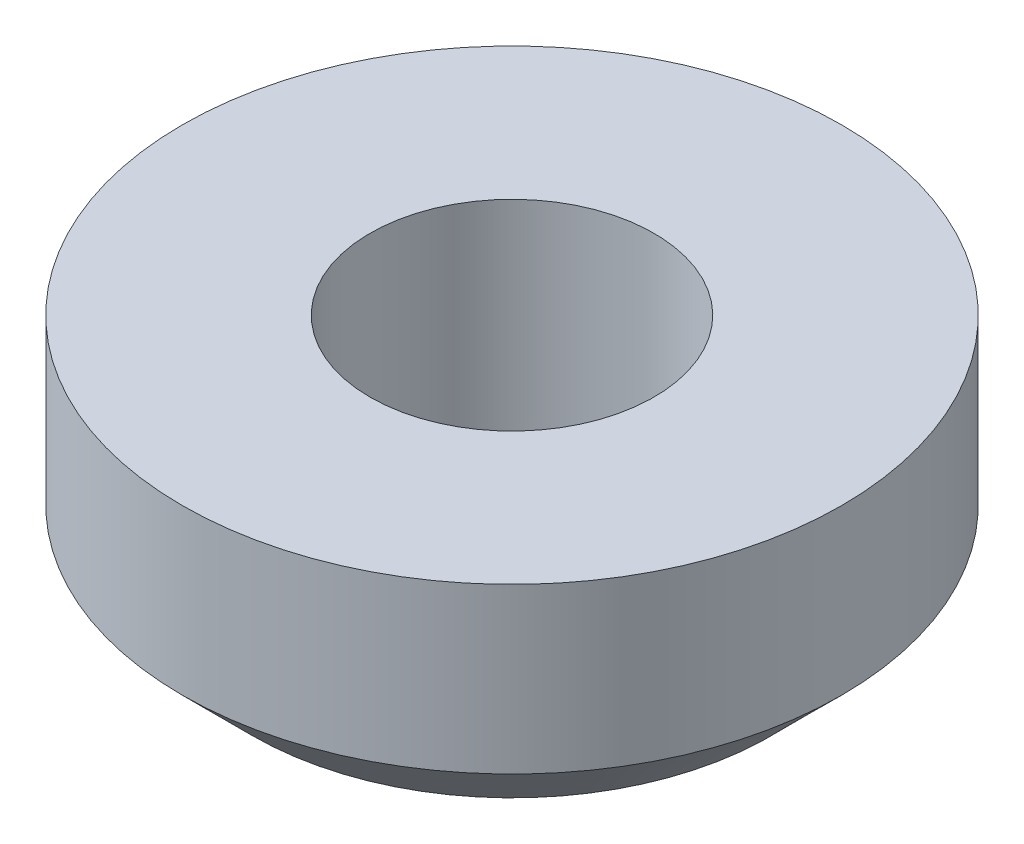
from build123d import *

# Parameters (mm, degrees)
SKETCH1_R           = 7.025
SKETCH1_R_2         = 3.025
BOSS_EXTRUDE1_DEPTH = 5
CHAMFER1_SIZE       = 1.5


with BuildPart() as part:
    # Sketch1 → Boss-Extrude1 (new body)
    with BuildSketch(Plane(origin=(0, 0, 0), x_dir=(1, 0, 0), z_dir=(0, 1, 0))):
        with Locations(Location((0, 0, 0), (0, 0, 270))):
            Circle(SKETCH1_R)
        with Locations(Location((0, 0, 0), (0, 0, 270))):
            Circle(SKETCH1_R_2, mode=Mode.SUBTRACT)
    extrude(amount=BOSS_EXTRUDE1_DEPTH)

    # Chamfer1
    chamfer1_edges = [part.edges().sort_by_distance(p)[0] for p in [
        (0, 0, -7.025),
    ]]
    chamfer(chamfer1_edges, length=CHAMFER1_SIZE)


solid = part.part
